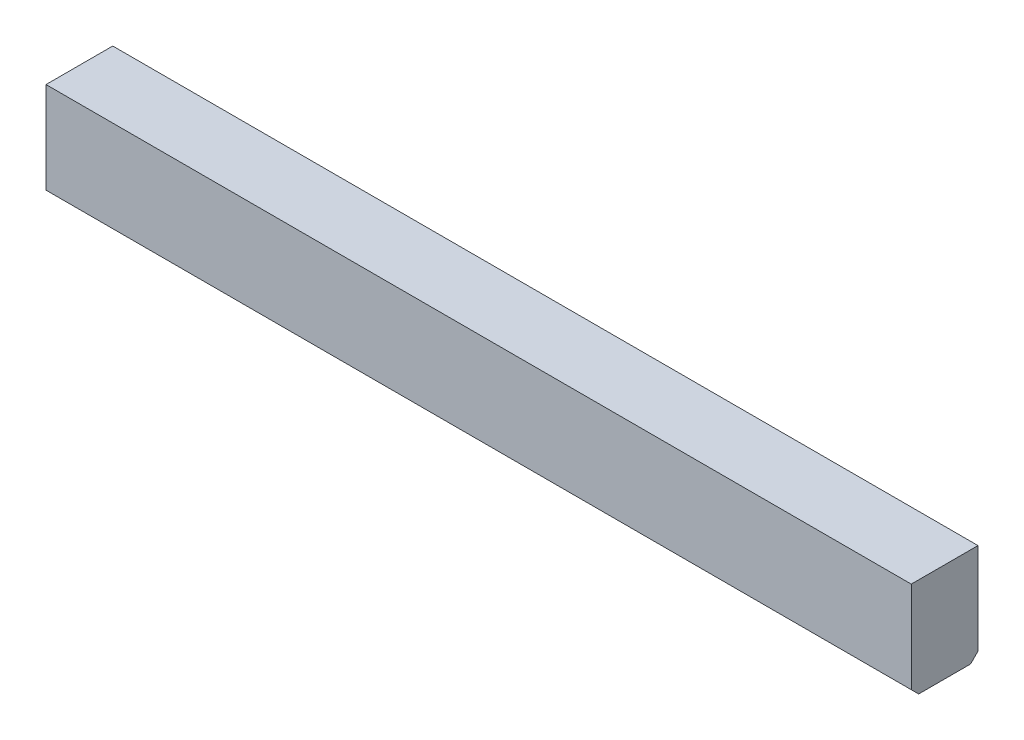
from build123d import *

# Parameters (mm, degrees)
ESQUISSE1_W        = 350
ESQUISSE1_H        = 40
BOSS_EXTRU_1_DEPTH = 27
CHANFREIN1_SIZE    = 3


with BuildPart() as part:
    # Esquisse1 → Boss.-Extru.1 (new body)
    with BuildSketch(Plane.XY):
        with Locations((175, 20)):
            Rectangle(ESQUISSE1_W, ESQUISSE1_H)
    extrude(amount=BOSS_EXTRU_1_DEPTH)

    # Chanfrein1
    chanfrein1_edges = [part.edges().sort_by_distance(p)[0] for p in [
        (175, 0, 0),
        (175, 0, 27),
    ]]
    chamfer(chanfrein1_edges, length=CHANFREIN1_SIZE)


solid = part.part
